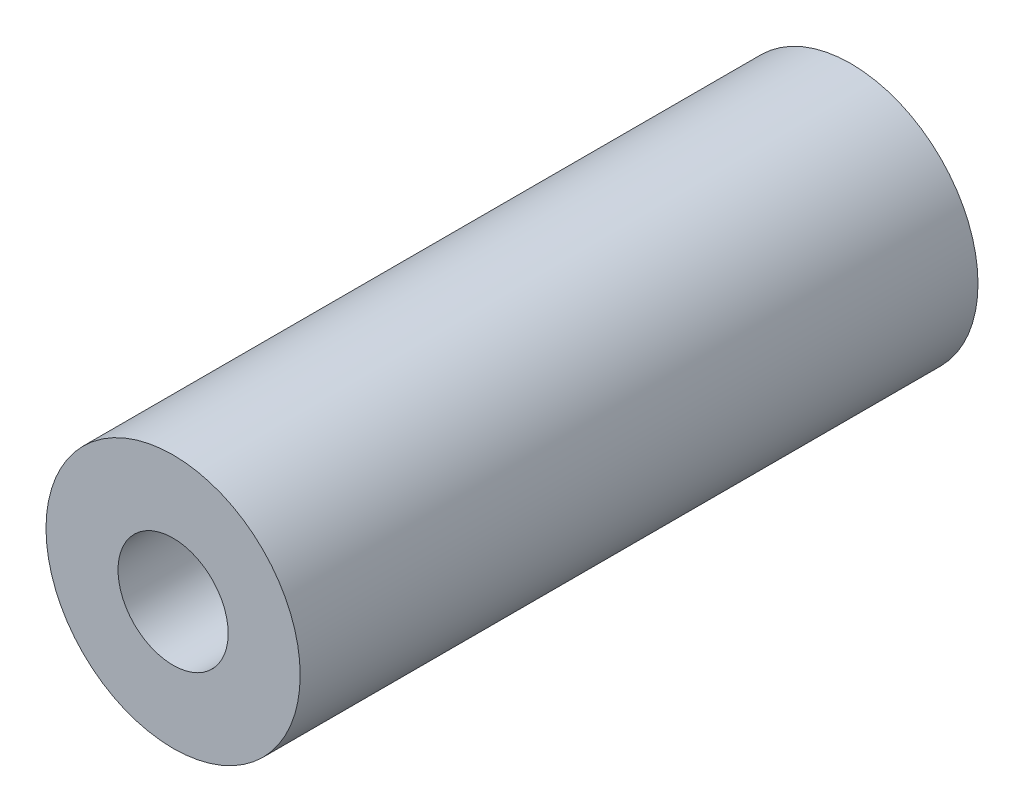
from build123d import *

# Parameters (mm, degrees)
BOSS_EXTRUDE1_DEPTH      = 25.4
BOSS_EXTRUDE1_DEPTH_BACK = 25.4
SKETCH3_R                = 9.525
SKETCH3_R_2              = 4.1275


with BuildPart() as part:
    # Sketch3 → Boss-Extrude1 (new, two sides: drawn at the far end of the back side and taken through both)
    with BuildSketch(Plane.XY.offset(-BOSS_EXTRUDE1_DEPTH_BACK)):
        Circle(SKETCH3_R)
        Circle(SKETCH3_R_2, mode=Mode.SUBTRACT)
    extrude(amount=BOSS_EXTRUDE1_DEPTH + BOSS_EXTRUDE1_DEPTH_BACK)


solid = part.part
